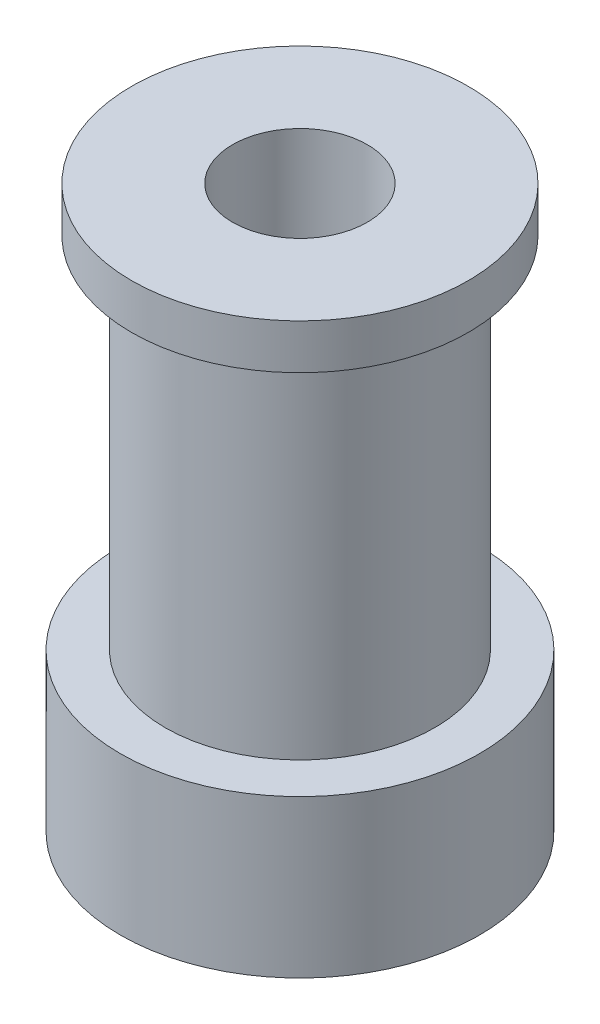
from build123d import *

# Parameters (mm, degrees)
EXTRUDE_1_DEPTH      = 2
EXTRUDE_1_DEPTH_BACK = 5
SKETCH_1_R           = 8
SKETCH_2_R           = 6
EXTRUDE_2_DEPTH      = 16
SKETCH_3_R           = 7.5
EXTRUDE_3_DEPTH      = 2
SKETCH_4_R           = 3
CUT_EXTRUDE_1_DEPTH  = 34


with BuildPart() as part:
    # 草图1 → 凸台-拉伸1 (new, two sides: drawn at the far end of the back side and taken through both)
    with BuildSketch(Plane(origin=(0, 0, 0), x_dir=(1, 0, 0), z_dir=(0, 1, 0)).offset(-EXTRUDE_1_DEPTH_BACK)):
        with Locations(Location((0, 0, 0), (0, 0, 270))):
            Circle(SKETCH_1_R)
    extrude(amount=EXTRUDE_1_DEPTH + EXTRUDE_1_DEPTH_BACK)

    # 草图2 → 凸台-拉伸2 (add)
    with BuildSketch(Plane(origin=(0, 2, 0), x_dir=(1, 0, 0), z_dir=(0, 1, 0))):
        with Locations(Location((0, 0, 0), (0, 0, 270))):
            Circle(SKETCH_2_R)
    extrude(amount=EXTRUDE_2_DEPTH)

    # 草图3 → 凸台-拉伸3 (add)
    with BuildSketch(Plane(origin=(0, 18, 0), x_dir=(1, 0, 0), z_dir=(0, 1, 0))):
        with Locations(Location((0, 0, 0), (0, 0, 270))):
            Circle(SKETCH_3_R)
    extrude(amount=EXTRUDE_3_DEPTH)

    # 草图4 → 切除-拉伸1 (cut)
    with BuildSketch(Plane(origin=(0, 20, 0), x_dir=(1, 0, 0), z_dir=(0, 1, 0))):
        with Locations(Location((0, 0, 0), (0, 0, 270))):
            Circle(SKETCH_4_R)
    extrude(amount=-CUT_EXTRUDE_1_DEPTH, mode=Mode.SUBTRACT)


solid = part.part
